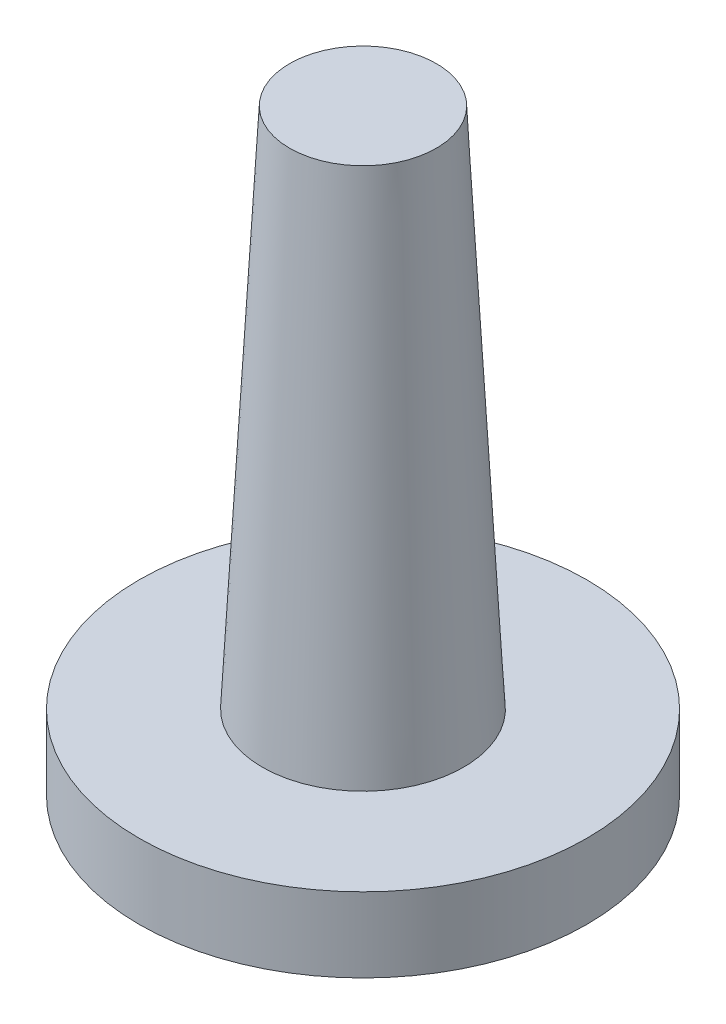
from build123d import *

# Parameters (mm, degrees)
ESQUISSE7_R        = 1.35
BOSS_EXTRU_5_DEPTH = 7
BOSS_EXTRU_5_TAPER = 3
ESQUISSE7_7_R      = 3
BOSS_EXTRU_6_DEPTH = 1


with BuildPart() as part:
    # Esquisse7 → Boss.-Extru.5 (new body)
    with BuildSketch(Plane(origin=(0, 0, 0), x_dir=(1, 0, 0), z_dir=(0, 1, 0))):
        Circle(ESQUISSE7_R)
    extrude(amount=BOSS_EXTRU_5_DEPTH, taper=BOSS_EXTRU_5_TAPER)

    # Esquisse7<7> → Boss.-Extru.6 (add)
    with BuildSketch(Plane(origin=(0, 0, 0), x_dir=(1, 0, 0), z_dir=(0, 1, 0))):
        Circle(ESQUISSE7_7_R)
    extrude(amount=-BOSS_EXTRU_6_DEPTH)


solid = part.part
